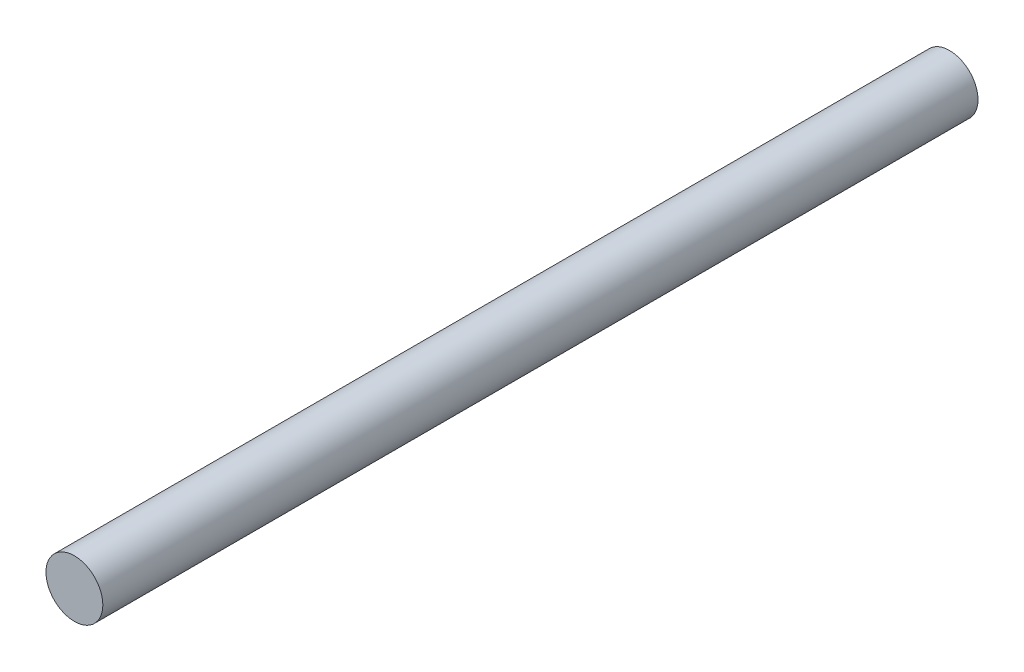
from build123d import *

# Parameters (mm, degrees)
SKETCH1_R           = 3.25
BOSS_EXTRUDE1_DEPTH = 100


with BuildPart() as part:
    # Sketch1 → Boss-Extrude1 (new body)
    with BuildSketch(Plane.XY):
        Circle(SKETCH1_R)
    extrude(amount=BOSS_EXTRUDE1_DEPTH)


solid = part.part
